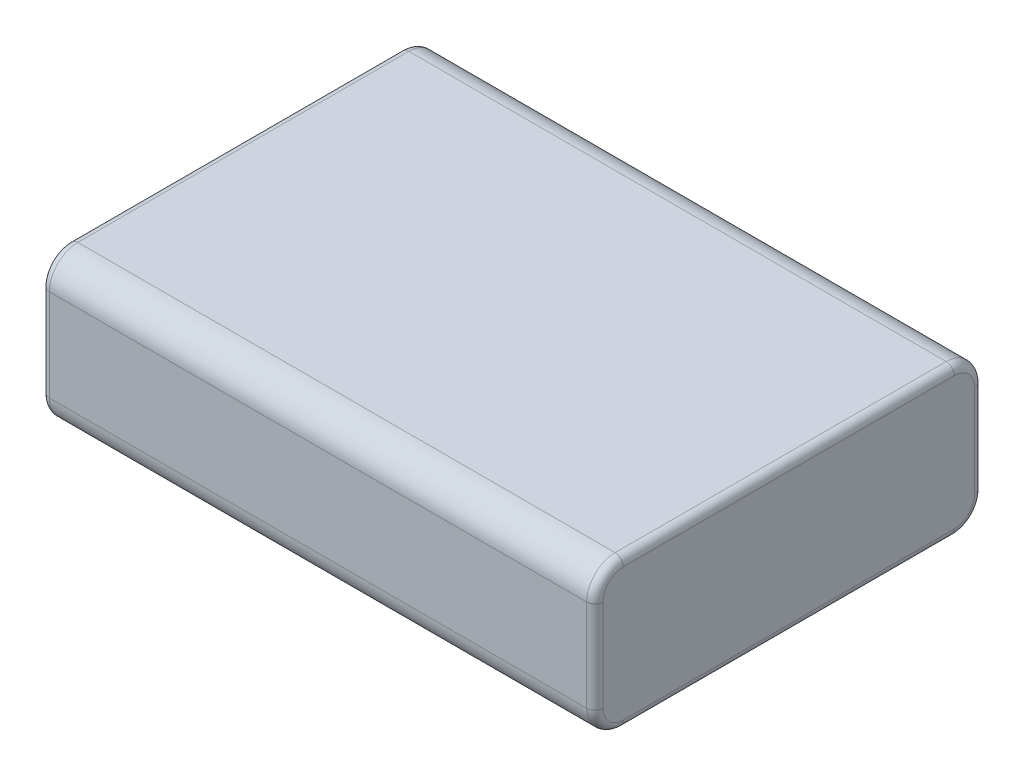
from build123d import *

# Parameters (mm, degrees)
SKETCH1_W           = 47.65
SKETCH1_H           = 18.3
BOSS_EXTRUDE1_DEPTH = 34
FILLET1_R           = 3.5
FILLET2_R           = 1


with BuildPart() as part:
    # Sketch1 → Boss-Extrude1 (new, symmetric)
    with BuildSketch(Plane(origin=(0, 0, 0), x_dir=(0, 0, -1), z_dir=(1, 0, 0))):
        Rectangle(SKETCH1_W, SKETCH1_H)
    extrude(amount=BOSS_EXTRUDE1_DEPTH, both=True)

    # Fillet1
    fillet1_edges = [part.edges().sort_by_distance(p)[0] for p in [
        (0, -9.15, -23.825),
        (0, -9.15, 23.825),
        (0, 9.15, 23.825),
        (0, 9.15, -23.825),
    ]]
    fillet(fillet1_edges, radius=FILLET1_R)

    # Fillet2
    fillet2_edges = [part.edges().sort_by_distance(p)[0] for p in [
        (-34, -9.15, 0),
        (34, -9.15, 0),
        (-34, 0, -23.825),
        (-34, 0, 23.825),
        (-34, 9.15, 0),
        (-34, 8.124873734, -22.799873734),
        (-34, 8.124873734, 22.799873734),
        (-34, -8.124873734, -22.799873734),
        (-34, -8.124873734, 22.799873734),
        (34, 0, 23.825),
        (34, 0, -23.825),
        (34, 9.15, 0),
        (34, 8.124873734, -22.799873734),
        (34, 8.124873734, 22.799873734),
        (34, -8.124873734, -22.799873734),
        (34, -8.124873734, 22.799873734),
    ]]
    fillet(fillet2_edges, radius=FILLET2_R)


solid = part.part
